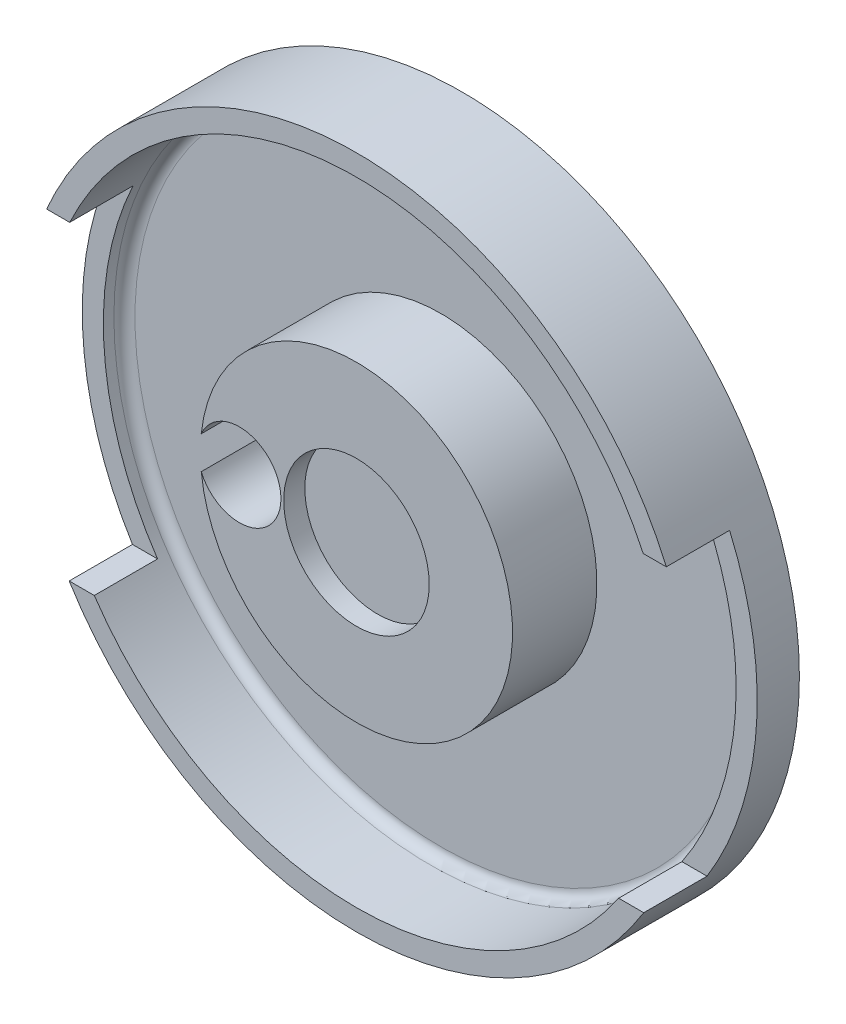
from build123d import *

# Parameters (mm, degrees)
SKETCH1_R           = 16
BOSS_EXTRUDE1_DEPTH = 5
SKETCH3_R           = 15
CUT_EXTRUDE1_DEPTH  = 4
FILLET1_R           = 0.5
SKETCH7_W           = 5.268501054
SKETCH7_H           = 14.735182388
CUT_EXTRUDE2_DEPTH  = 11
SKETCH8_R           = 7.4
BOSS_EXTRUDE2_DEPTH = 4
SKETCH9_R           = 3.45
CUT_EXTRUDE3_DEPTH  = 1
SKETCH11_R          = 1.969447503
CUT_EXTRUDE4_DEPTH  = 10


with BuildPart() as part:
    # Sketch1 → Boss-Extrude1 (new body)
    with BuildSketch(Plane.XY):
        Circle(SKETCH1_R)
    extrude(amount=BOSS_EXTRUDE1_DEPTH)

    # Sketch3 → Cut-Extrude1 (cut)
    with BuildSketch(Plane.XY.offset(5)):
        Circle(SKETCH3_R)
    extrude(amount=-CUT_EXTRUDE1_DEPTH, mode=Mode.SUBTRACT)

    # Fillet1
    fillet1_edges = [part.edges().sort_by_distance(p)[0] for p in [
        (-15, 0, 1),
    ]]
    fillet(fillet1_edges, radius=FILLET1_R)

    # Sketch7 → Cut-Extrude2 (cut)
    with BuildSketch(Plane.XY.offset(13)):
        with Locations((-14.456252894, -1.028256592)):
            Rectangle(SKETCH7_W, SKETCH7_H)
    cut_extrude2 = extrude(amount=-CUT_EXTRUDE2_DEPTH, mode=Mode.SUBTRACT)

    # Mirror1: Cut-Extrude2 across plane
    add(cut_extrude2.mirror(Plane(origin=(0, 0, 0), x_dir=(0, 0, 1), z_dir=(1, 0, 0))), mode=Mode.SUBTRACT)

    # Sketch8 → Boss-Extrude2 (add)
    with BuildSketch(Plane.XY.offset(1)):
        Circle(SKETCH8_R)
    extrude(amount=BOSS_EXTRUDE2_DEPTH)

    # Sketch9 → Cut-Extrude3 (cut)
    with BuildSketch(Plane.XY.offset(5)):
        Circle(SKETCH9_R)
    extrude(amount=-CUT_EXTRUDE3_DEPTH, mode=Mode.SUBTRACT)

    # Sketch11 → Cut-Extrude4 (cut)
    with BuildSketch(Plane.XY.offset(5)):
        with Locations((-5.549660814, 0)):
            Circle(SKETCH11_R)
    extrude(amount=-CUT_EXTRUDE4_DEPTH, mode=Mode.SUBTRACT)


solid = part.part
